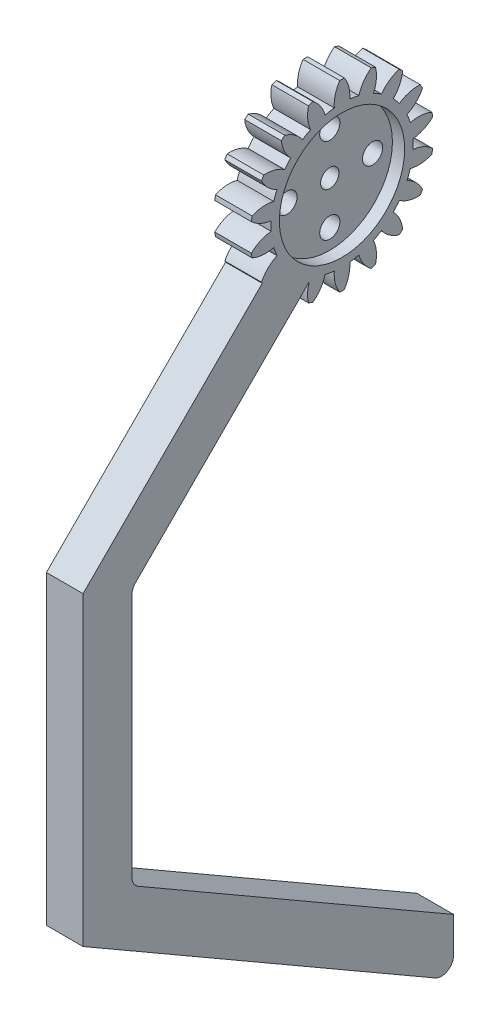
from build123d import *

# Parameters (mm, degrees)
BASPROSKE_W         = 6
BASPROSKE_H         = 15
TOOTHCUT_DEPTH      = 23.045407685
TEETHCUTS_COUNT     = 18
TEETHCUTS_ANGLE     = 340
BORSKE_R            = 1.5
BORE_DEPTH          = 50.0000508
MOVE_BODY_10_ANGLE  = 10
EXTRUDE_2_DEPTH     = 6
SKETCH_2_R          = 1.65
CUT_EXTRUDE_1_DEPTH = 6
SKETCH_3_R          = 10.25
CUT_EXTRUDE_2_DEPTH = 2
FILLET_1_R          = 2


with BuildPart() as part:
    # BasProSke → Base-Revolve (revolve)
    with BuildSketch(Plane(origin=(0, 0, 0), x_dir=(1, 0, 0), z_dir=(0, 1, 0))):
        with Locations((3, 7.5)):
            Rectangle(BASPROSKE_W, BASPROSKE_H)
    revolve(axis=Axis((-10, 0, 0), (1, 0, 0)))

    # TooCutSke → ToothCut (cut, through all)
    with BuildSketch(Plane(origin=(0, 0, 0), x_dir=(0, 0, -1), z_dir=(1, 0, 0))):
        with BuildLine():
            ThreePointArc((0.759974923, 11.599129886), (0, 11.624), (-0.759974923, 11.599129886))
            ThreePointArc((-0.759974923, 11.599129886), (-1.229186471, 13.354767823), (-2.254227748, 14.855339189))
            ThreePointArc((-2.254227748, 14.855339189), (0, 15.0254), (2.254227748, 14.855339189))
            ThreePointArc((2.254227748, 14.855339189), (1.229186471, 13.354767823), (0.759974923, 11.599129886))
        make_face()
    toothcut = extrude(amount=TOOTHCUT_DEPTH, mode=Mode.SUBTRACT)

    # TeethCuts: ToothCut ×18 about axis
    teethcuts_axis = Axis((-10, 0, 0), (1, 0, 0))
    for i in range(1, TEETHCUTS_COUNT):
        add(toothcut.rotate(teethcuts_axis, i * TEETHCUTS_ANGLE / (TEETHCUTS_COUNT - 1)), mode=Mode.SUBTRACT)

    # BorSke → Bore (cut, symmetric)
    with BuildSketch(Plane(origin=(0, 0, 0), x_dir=(0, 0, -1), z_dir=(1, 0, 0))):
        Circle(BORSKE_R)
    extrude(amount=BORE_DEPTH, both=True, mode=Mode.SUBTRACT)


with BuildPart() as part_1:
    # Move Body 10: moved
    add(part.part.rotate(Axis((0, 0, 0), (-1, 0, 0)), MOVE_BODY_10_ANGLE))

    # 草图1 → 凸台-拉伸2 (add)
    with BuildSketch(Plane(origin=(6, 0, 0), x_dir=(0, 0, -1), z_dir=(1, 0, 0))):
        Polygon((-10.545854675, -4.889000426), (-42.365659829, -36.708805579), (-42.365659829, -86.708805579), (18.256118436, -121.708805579), (18.256118436, -112.471201272), (-34.365659829, -82.090003426), (-34.365659829, -40.022514078), (-4.889000426, -10.545854675), align=None)
    extrude(amount=-EXTRUDE_2_DEPTH)

    # 草图2 → 切除-拉伸1 (cut)
    with BuildSketch(Plane(origin=(6, 0, 0), x_dir=(0, 0, -1), z_dir=(1, 0, 0))):
        with Locations((-7, 0)):
            Circle(SKETCH_2_R)
        with Locations((0, 7)):
            Circle(SKETCH_2_R)
        with Locations((7, 0)):
            Circle(SKETCH_2_R)
        with Locations((0, -7)):
            Circle(SKETCH_2_R)
    extrude(amount=-CUT_EXTRUDE_1_DEPTH, mode=Mode.SUBTRACT)

    # 草图3 → 切除-拉伸2 (cut)
    with BuildSketch(Plane(origin=(6, 0, 0), x_dir=(0, 0, -1), z_dir=(1, 0, 0))):
        Circle(SKETCH_3_R)
    extrude(amount=-CUT_EXTRUDE_2_DEPTH, mode=Mode.SUBTRACT)

    # 圆角1
    fillet_1_edges = [part_1.edges().sort_by_distance(p)[0] for p in [
        (3, -82.090003426, 34.365659829),
        (3, -40.022514078, 34.365659829),
        (3, -121.708805579, -18.256118436),
    ]]
    fillet(fillet_1_edges, radius=FILLET_1_R)


solid = part_1.part
